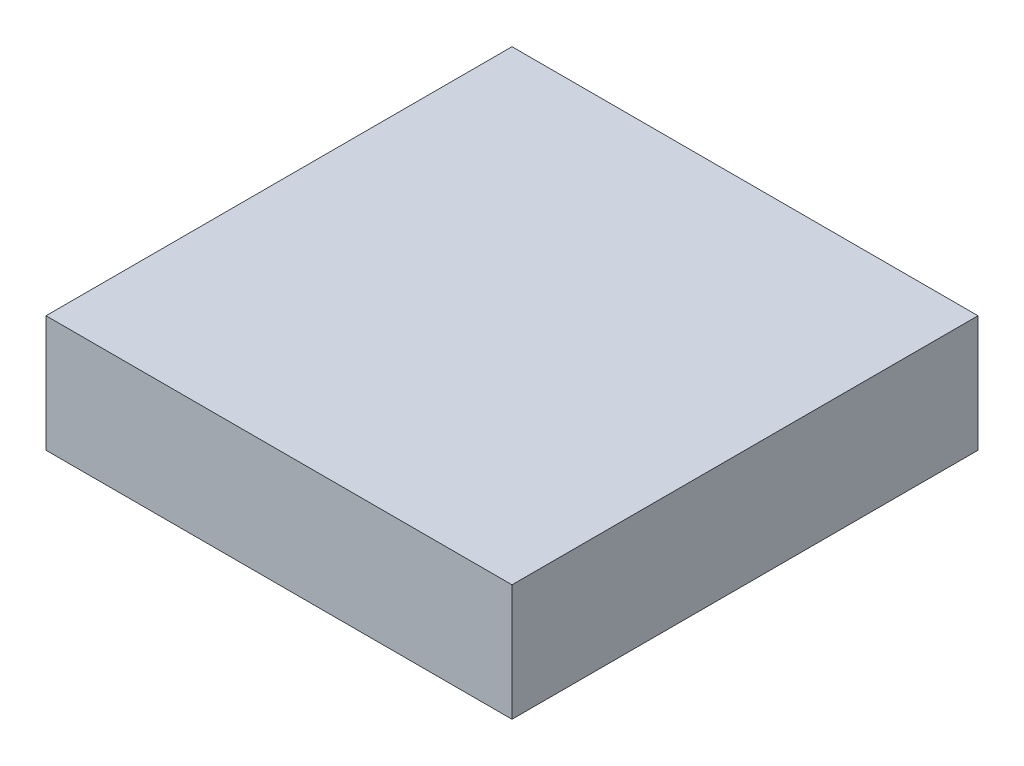
from build123d import *

# Parameters (mm, degrees)
SKETCH1_W           = 101.6
SKETCH1_H           = 101.6
BOSS_EXTRUDE1_DEPTH = 25.4


with BuildPart() as part:
    # Sketch1 → Boss-Extrude1 (new body)
    with BuildSketch(Plane(origin=(0, 0, 0), x_dir=(1, 0, 0), z_dir=(0, 1, 0))):
        Rectangle(SKETCH1_W, SKETCH1_H)
    extrude(amount=BOSS_EXTRUDE1_DEPTH)


solid = part.part
